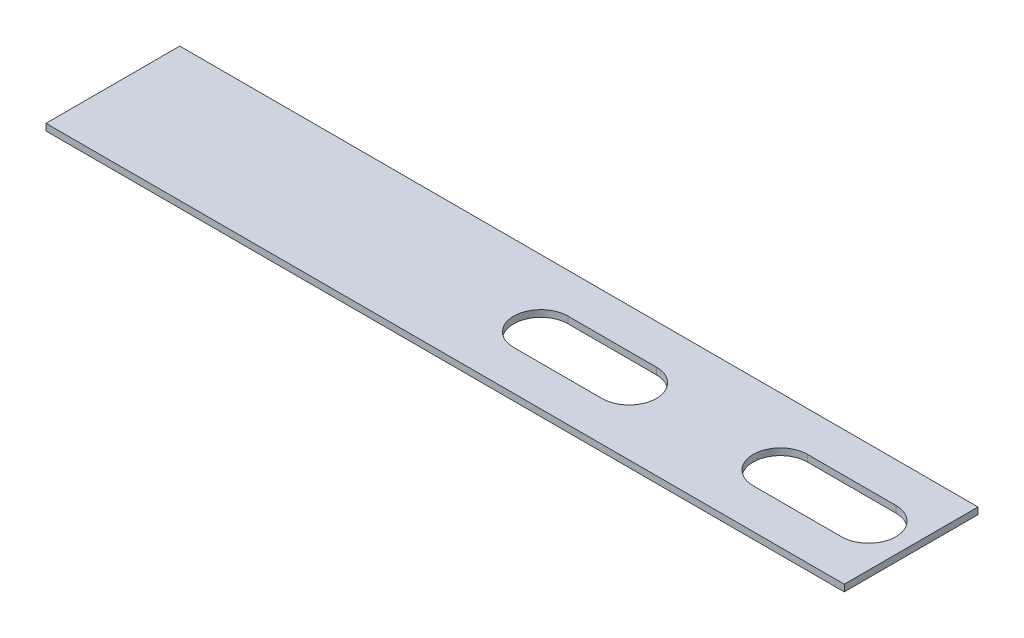
from build123d import *

# Parameters (mm, degrees)
SKETCH1_W           = 59.69
SKETCH1_H           = 0.5
EXTRUDE_THIN1_DEPTH = 10
SKETCH3_OUTSIDE_W   = 73.794
SKETCH3_OUTSIDE_H   = 24.104
SKETCH3_OUTSIDE_W_2 = 59.69
SKETCH3_OUTSIDE_H_2 = 10
CUT_EXTRUDE5_DEPTH  = 2.54


with BuildPart() as part:
    # Sketch1 → Extrude-Thin1 (new body)
    with BuildSketch(Plane.XY):
        with Locations((29.845, -0.25)):
            Rectangle(SKETCH1_W, SKETCH1_H)
    extrude(amount=EXTRUDE_THIN1_DEPTH)

    # Sketch3 outside → Cut-Extrude5 (cut)
    # profile 1 of 3: a face of its own
    with BuildSketch(Plane(origin=(0, 0, 0), x_dir=(1, 0, 0), z_dir=(0, 1, 0))):
        with Locations((29.845, -5)):
            Rectangle(SKETCH3_OUTSIDE_W, SKETCH3_OUTSIDE_H)
        with Locations((29.845, -5)):
            Rectangle(SKETCH3_OUTSIDE_W_2, SKETCH3_OUTSIDE_H_2, mode=Mode.SUBTRACT)
    # profile 2 of 3: a face of its own
    with BuildSketch(Plane(origin=(0, 0, 0), x_dir=(1, 0, 0), z_dir=(0, 1, 0))):
        with BuildLine():
            Line((32.004, -2.968), (38.608, -2.968))
            ThreePointArc((38.608, -2.968), (40.64, -5), (38.608, -7.032))
            Line((38.608, -7.032), (32.004, -7.032))
            ThreePointArc((32.004, -7.032), (29.972, -5), (32.004, -2.968))
        make_face()
    # profile 3 of 3: a face of its own
    with BuildSketch(Plane(origin=(0, 0, 0), x_dir=(1, 0, 0), z_dir=(0, 1, 0))):
        with BuildLine():
            Line((49.911, -2.968), (56.515, -2.968))
            ThreePointArc((56.515, -2.968), (58.547, -5), (56.515, -7.032))
            Line((56.515, -7.032), (49.911, -7.032))
            ThreePointArc((49.911, -7.032), (47.879, -5), (49.911, -2.968))
        make_face()
    extrude(amount=-CUT_EXTRUDE5_DEPTH, mode=Mode.SUBTRACT)


solid = part.part
